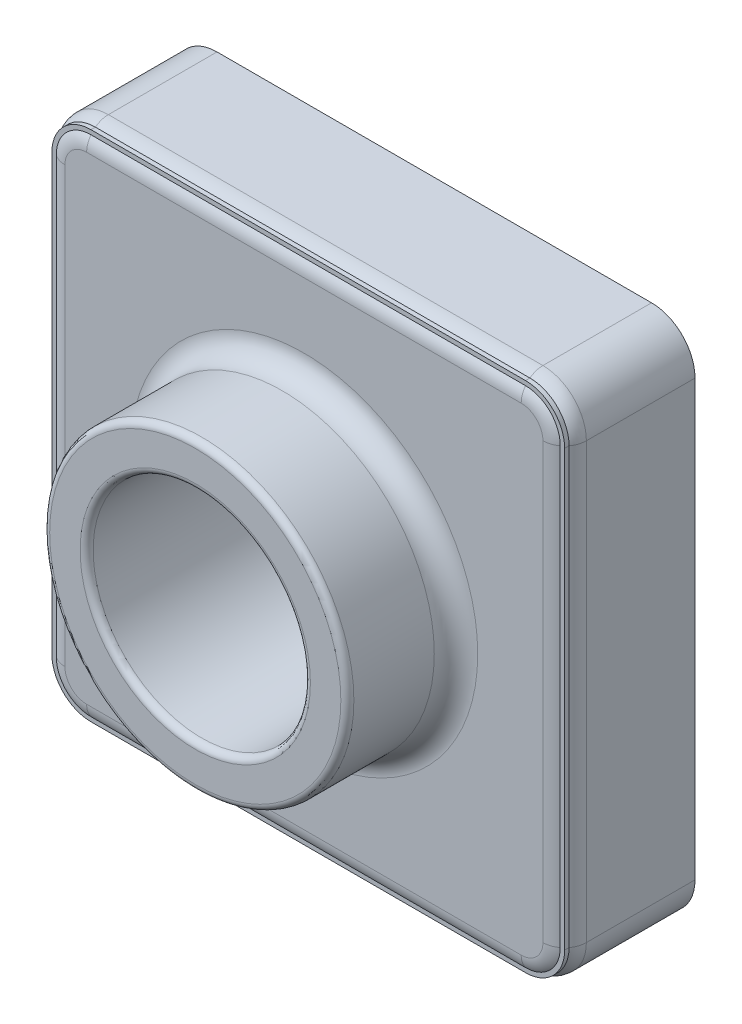
from build123d import *

# Parameters (mm, degrees)
SKETCH1_W           = 120
SKETCH1_H           = 120
BOSS_EXTRUDE1_DEPTH = 30
SKETCH2_R           = 35
BOSS_EXTRUDE2_DEPTH = 25
FILLET1_R           = 10
FILLET2_R           = 10
FILLET3_R           = 10
FILLET4_R           = 5
SKETCH9_R           = 25
CUT_EXTRUDE1_DEPTH  = 102.118742081
FILLET5_R           = 1.5
SHELL1_T            = -1
FILLET6_R           = 5


with BuildPart() as part:
    # Sketch1 → Boss-Extrude1 (new body)
    with BuildSketch(Plane.XY):
        Rectangle(SKETCH1_W, SKETCH1_H)
    extrude(amount=-BOSS_EXTRUDE1_DEPTH)

    # Sketch2 → Boss-Extrude2 (add)
    with BuildSketch(Plane.XY):
        Circle(SKETCH2_R)
    extrude(amount=BOSS_EXTRUDE2_DEPTH)

    # Fillet1
    fillet1_edges = [part.edges().sort_by_distance(p)[0] for p in [
        (60, 60, -15),
    ]]
    fillet(fillet1_edges, radius=FILLET1_R)

    # Fillet2
    fillet2_edges = [part.edges().sort_by_distance(p)[0] for p in [
        (-60, 60, -15),
    ]]
    fillet(fillet2_edges, radius=FILLET2_R)

    # Fillet3
    fillet3_edges = [part.edges().sort_by_distance(p)[0] for p in [
        (60, -60, -15),
        (-60, -60, -15),
    ]]
    fillet(fillet3_edges, radius=FILLET3_R)

    # Fillet4
    fillet4_edges = [part.edges().sort_by_distance(p)[0] for p in [
        (-35, 0, 0),
    ]]
    fillet(fillet4_edges, radius=FILLET4_R)

    # Sketch9 → Cut-Extrude1 (cut, through all)
    with BuildSketch(Plane.XY.offset(25)):
        Circle(SKETCH9_R)
    extrude(amount=-CUT_EXTRUDE1_DEPTH, mode=Mode.SUBTRACT)

    # Fillet5
    fillet5_edges = [part.edges().sort_by_distance(p)[0] for p in [
        (-35, 0, 25),
        (-25, 0, 25),
    ]]
    fillet(fillet5_edges, radius=FILLET5_R)

    # Shell1
    shell1_openings = [part.faces().sort_by_distance(p)[0] for p in [
        (-58.302943725, 0, -30),
    ]]
    offset(amount=SHELL1_T, openings=shell1_openings, kind=Kind.INTERSECTION)

    # Fillet6
    fillet6_edges = [part.edges().sort_by_distance(p)[0] for p in [
        (0, 60, 0),
        (57.071067812, 57.071067812, 0),
        (-60, 0, 0),
        (-57.071067812, 57.071067812, 0),
        (0, -60, 0),
        (60, 0, 0),
        (57.071067812, -57.071067812, 0),
        (-57.071067812, -57.071067812, 0),
    ]]
    fillet(fillet6_edges, radius=FILLET6_R)


solid = part.part
